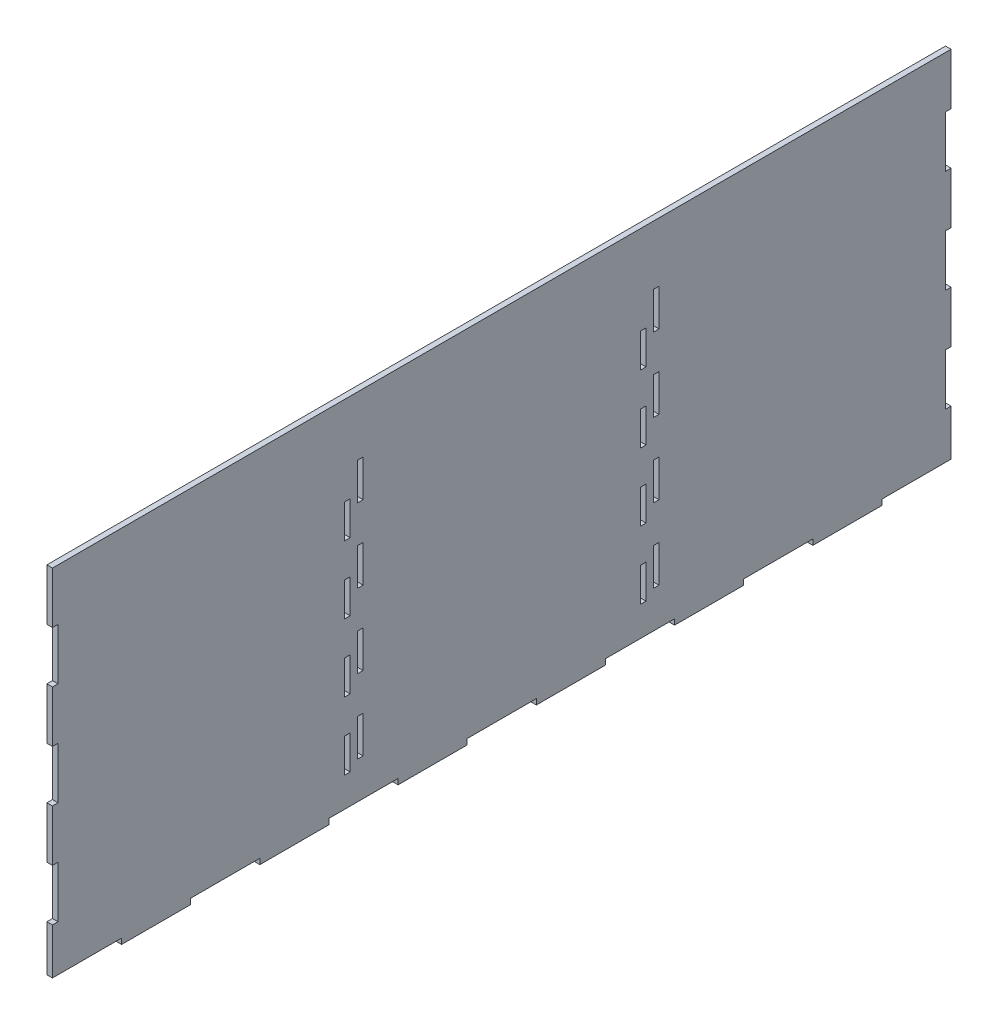
from build123d import *

# Parameters (mm, degrees)
BOSS_EXTRUDE1_DEPTH = 4.7625
SKETCH3_W           = 4.7625
SKETCH3_H           = 31.75
SKETCH3_H_2         = 29.028571429
CUT_EXTRUDE1_DEPTH  = 417.575850499


with BuildPart() as part:
    # Sketch1 → Boss-Extrude1 (new body)
    with BuildSketch(Plane(origin=(0, 0, 0), x_dir=(0, 0, -1), z_dir=(1, 0, 0))):
        Polygon((381, 152.4), (-385.7625, 152.4), (-385.7625, 108.176785714), (-381, 108.176785714), (-381, 63.953571429), (-385.7625, 63.953571429), (-385.7625, 19.730357143), (-381, 19.730357143), (-381, -24.492857143), (-385.7625, -24.492857143), (-385.7625, -68.716071429), (-381, -68.716071429), (-381, -112.939285714), (-385.7625, -112.939285714), (-385.7625, -152.4), (-326.414423077, -152.4), (-326.414423077, -157.1625), (-267.066346154, -157.1625), (-267.066346154, -152.4), (-207.718269231, -152.4), (-207.718269231, -157.1625), (-148.370192308, -157.1625), (-148.370192308, -152.4), (-89.022115385, -152.4), (-89.022115385, -157.1625), (-29.674038462, -157.1625), (-29.674038462, -152.4), (29.674038462, -152.4), (29.674038462, -157.1625), (89.022115385, -157.1625), (89.022115385, -152.4), (148.370192308, -152.4), (148.370192308, -157.1625), (207.718269231, -157.1625), (207.718269231, -152.4), (267.066346154, -152.4), (267.066346154, -157.1625), (326.414423077, -157.1625), (326.414423077, -152.4), (385.7625, -152.4), (385.7625, -112.939285714), (381, -112.939285714), (381, -68.716071429), (385.7625, -68.716071429), (385.7625, -24.492857143), (381, -24.492857143), (381, 19.730357143), (385.7625, 19.730357143), (385.7625, 63.953571429), (381, 63.953571429), (381, 108.176785714), (385.7625, 108.176785714), (385.7625, 152.4), align=None)
    extrude(amount=BOSS_EXTRUDE1_DEPTH)

    # Sketch3 → Cut-Extrude1 (cut, through all)
    with BuildSketch(Plane(origin=(4.7625, 0, 0), x_dir=(0, 0, -1), z_dir=(1, 0, 0))):
        with Locations((-121.44375, -104.775)):
            Rectangle(SKETCH3_W, SKETCH3_H)
        with Locations((-121.44375, -41.275)):
            Rectangle(SKETCH3_W, SKETCH3_H)
        with Locations((-121.44375, 22.225)):
            Rectangle(SKETCH3_W, SKETCH3_H)
        with Locations((-121.44375, 85.725)):
            Rectangle(SKETCH3_W, SKETCH3_H)
        with Locations((-132.55625, 61.685714285)):
            Rectangle(SKETCH3_W, SKETCH3_H_2)
        with Locations((-132.55625, 3.628571428)):
            Rectangle(SKETCH3_W, SKETCH3_H_2)
        with Locations((-132.55625, -54.428571428)):
            Rectangle(SKETCH3_W, SKETCH3_H_2)
        with Locations((-132.55625, -112.485714286)):
            Rectangle(SKETCH3_W, SKETCH3_H_2)
        with Locations((132.55625, 85.725)):
            Rectangle(SKETCH3_W, SKETCH3_H)
        with Locations((121.44375, 61.685714285)):
            Rectangle(SKETCH3_W, SKETCH3_H_2)
        with Locations((132.55625, 22.225)):
            Rectangle(SKETCH3_W, SKETCH3_H)
        with Locations((121.44375, 3.628571428)):
            Rectangle(SKETCH3_W, SKETCH3_H_2)
        with Locations((132.55625, -41.275)):
            Rectangle(SKETCH3_W, SKETCH3_H)
        with Locations((121.44375, -54.428571428)):
            Rectangle(SKETCH3_W, SKETCH3_H_2)
        with Locations((132.55625, -104.775)):
            Rectangle(SKETCH3_W, SKETCH3_H)
        with Locations((121.44375, -112.485714286)):
            Rectangle(SKETCH3_W, SKETCH3_H_2)
    extrude(amount=-CUT_EXTRUDE1_DEPTH, mode=Mode.SUBTRACT)


solid = part.part
